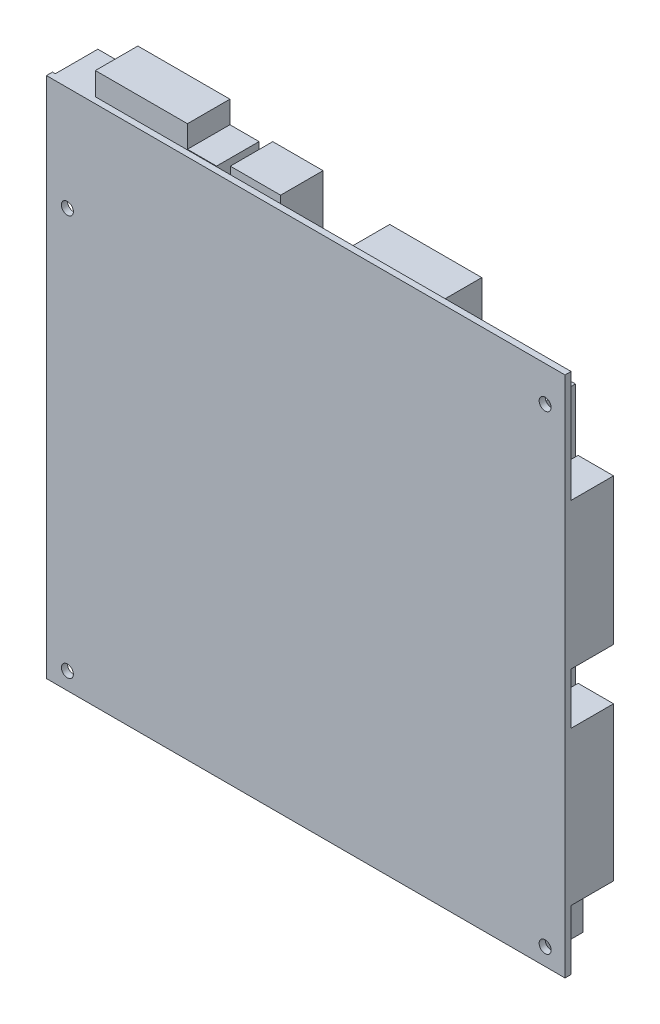
from build123d import *

# Parameters (mm, degrees)
SKETCH_1_W      = 170.942557362
SKETCH_1_H      = 172.163575629
EXTRUDE_1_DEPTH = 2
SKETCH_2_W      = 50
SKETCH_2_H      = 87
EXTRUDE_2_DEPTH = 35
SKETCH_3_W      = 30.35102549
SKETCH_3_H      = 31.572043757
SKETCH_3_W_2    = 16.570962193
SKETCH_3_H_2    = 17.704764869
SKETCH_3_H_3    = 2.442036534
SKETCH_3_W_3    = 86.692296948
SKETCH_3_H_4    = 24.071502975
SKETCH_3_W_4    = 9.942577316
SKETCH_3_H_5    = 43.258932884
SKETCH_3_W_5    = 59.829895076
SKETCH_3_H_6    = 13.780063298
SKETCH_3_W_6    = 55.989922961
SKETCH_3_H_7    = 12.893447817
SKETCH_3_W_7    = 34.783578006
SKETCH_3_H_8    = 10.603172478
SKETCH_3_W_8    = 11.686889126
SKETCH_3_H_9    = 48.143005951
SKETCH_3_H_10   = 50.585042485
SKETCH_3_W_9    = 9.605807423
SKETCH_3_H_11   = 6.465349072
EXTRUDE_3_DEPTH = 14
CHAMFER_1_SIZE  = 2


with BuildPart() as part:
    # 草图1 → 凸台-拉伸1 (new body)
    with BuildSketch(Plane.XY):
        with Locations((-78.914431177, 80.434949445)):
            Rectangle(SKETCH_1_W, SKETCH_1_H)
        with BuildLine():
            ThreePointArc((-159.455, 0), (-157.48, -1.975), (-155.505, 0))
            ThreePointArc((-155.505, 0), (-157.48, 1.975), (-159.455, 0))
        make_face(mode=Mode.SUBTRACT)
        with BuildLine():
            ThreePointArc((-1.975, 0), (0, -1.975), (1.975, 0))
            ThreePointArc((1.975, 0), (0, 1.975), (-1.975, 0))
        make_face(mode=Mode.SUBTRACT)
        with BuildLine():
            ThreePointArc((-1.975, 154.919999989), (0, 152.944999989), (1.975, 154.919999989))
            ThreePointArc((1.975, 154.919999989), (0, 156.894999989), (-1.975, 154.919999989))
        make_face(mode=Mode.SUBTRACT)
        with BuildLine():
            ThreePointArc((-159.455, 132.08), (-157.48, 130.105), (-155.505, 132.08))
            ThreePointArc((-155.505, 132.08), (-157.48, 134.055), (-159.455, 132.08))
        make_face(mode=Mode.SUBTRACT)
    extrude(amount=-EXTRUDE_1_DEPTH)

    # 草图2 → 凸台-拉伸2 (add)
    with BuildSketch(Plane(origin=(0, 0, -2), x_dir=(-1, 0, 0), z_dir=(0, 0, -1))):
        with Locations((50, 87.178999994)):
            Rectangle(SKETCH_2_W, SKETCH_2_H)
    extrude(amount=EXTRUDE_2_DEPTH)

    # 草图3 → 凸台-拉伸3 (add)
    with BuildSketch(Plane(origin=(0, 0, -2), x_dir=(-1, 0, 0), z_dir=(0, 0, -1))):
        with Locations((52.052029306, 148.811972389)):
            Rectangle(SKETCH_3_W, SKETCH_3_H)
        with Locations((97.491351952, 157.664354825)):
            Rectangle(SKETCH_3_W_2, SKETCH_3_H_2)
        Polygon((150.256784199, 166.516737259), (119.905758708, 166.516737259), (119.905758708, 160.251119597), (119.905758708, 153.259967505), (150.256784199, 153.259967505), align=None)
        with Locations((97.491351952, 167.737755526)):
            Rectangle(SKETCH_3_W_2, SKETCH_3_H_3)
        Polygon((119.905758708, 166.716468669), (119.905758708, 166.516737259), (150.256784199, 166.516737259), (150.256784199, 166.716468669), (150.256784199, 174.017278041), (119.905758708, 174.017278041), align=None)
        Polygon((163.445120655, 166.516737259), (150.256784199, 166.516737259), (150.256784199, 153.259967505), (150.256784199, 151.587551841), (163.445120655, 151.587551841), align=None)
        with Locations((121.039561384, 62.555753395)):
            Rectangle(SKETCH_3_W_3, SKETCH_3_H_4)
        with Locations((159.4144212, 26.797361293)):
            Rectangle(SKETCH_3_W_4, SKETCH_3_H_5)
        with Locations((114.236745326, 1.243193279)):
            Rectangle(SKETCH_3_W_5, SKETCH_3_H_6)
        with Locations((31.520690489, 0.799885539)):
            Rectangle(SKETCH_3_W_6, SKETCH_3_H_7)
        with Locations((23.374350658, 16.168791166)):
            Rectangle(SKETCH_3_W_7, SKETCH_3_H_8)
        with Locations((-0.713402941, 105.640255096)):
            Rectangle(SKETCH_3_W_8, SKETCH_3_H_9)
        with Locations((-0.713402941, 39.356406323)):
            Rectangle(SKETCH_3_W_8, SKETCH_3_H_10)
        with Locations((115.102854997, 163.483794133)):
            Rectangle(SKETCH_3_W_9, SKETCH_3_H_11)
    extrude(amount=EXTRUDE_3_DEPTH)

    # 倒角1
    chamfer_1_edges = [part.edges().sort_by_distance(p)[0] for p in [
        (-25, 87.178999994, -37),
        (-50, 43.678999994, -37),
        (-75, 87.178999994, -37),
        (-50, 130.678999994, -37),
    ]]
    chamfer(chamfer_1_edges, length=CHAMFER_1_SIZE)


solid = part.part
